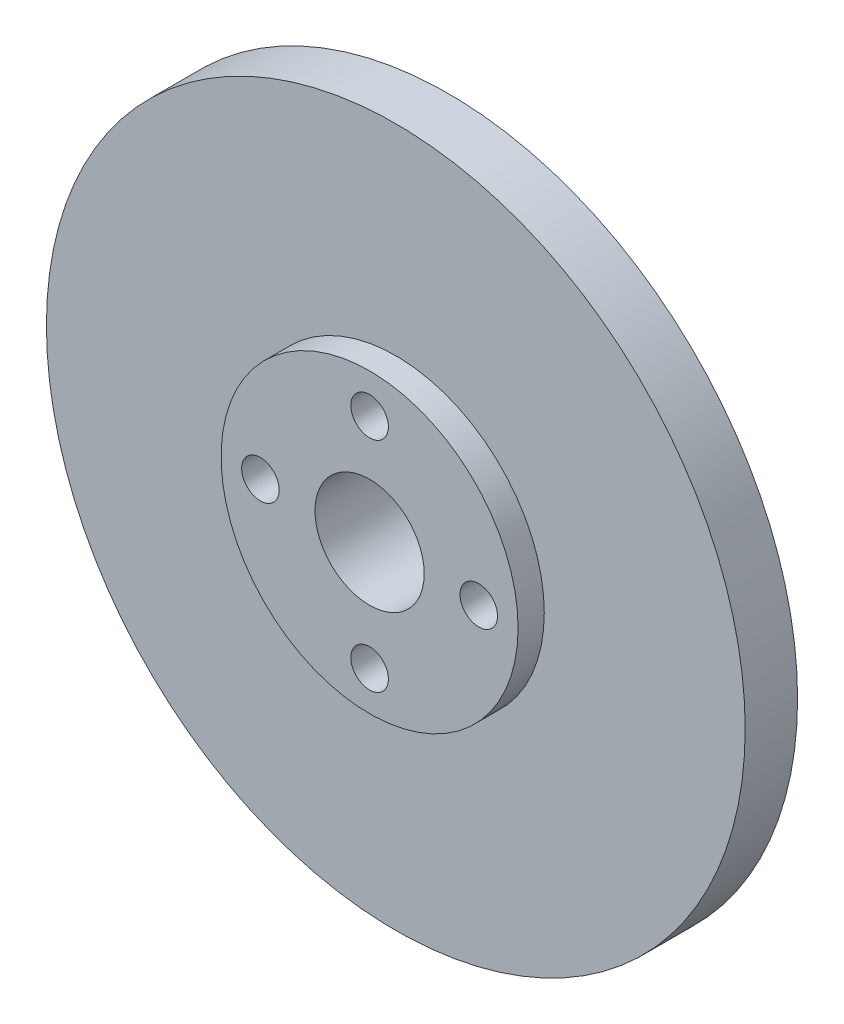
from build123d import *

# Parameters (mm, degrees)
SKETCH1_R               = 40
BOSS_EXTRUDE1_DEPTH     = 6
SKETCH2_R               = 17
BOSS_EXTRUDE2_DEPTH     = 3
CUT_EXTRUDE1_DEPTH      = 58.280013966
CUT_EXTRUDE1_DEPTH_BACK = 58.280013966
SKETCH3_R               = 6.25
SKETCH3_R_2             = 2.15


with BuildPart() as part:
    # Sketch1 → Boss-Extrude1 (new body)
    with BuildSketch(Plane.XY):
        Circle(SKETCH1_R)
    extrude(amount=BOSS_EXTRUDE1_DEPTH)

    # Sketch2 → Boss-Extrude2 (add)
    with BuildSketch(Plane.XY.offset(6)):
        Circle(SKETCH2_R)
    extrude(amount=BOSS_EXTRUDE2_DEPTH)

    # Sketch3 → Cut-Extrude1 (cut, two sides: drawn at the far end of the back side and taken through both)
    with BuildSketch(Plane.XY.offset(9).offset(-CUT_EXTRUDE1_DEPTH_BACK)):
        Circle(SKETCH3_R)
        with Locations((0, 12.5)):
            Circle(SKETCH3_R_2)
        with Locations((12.5, 0)):
            Circle(SKETCH3_R_2)
        with Locations((0, -12.5)):
            Circle(SKETCH3_R_2)
        with Locations((-12.5, 0)):
            Circle(SKETCH3_R_2)
    extrude(amount=CUT_EXTRUDE1_DEPTH + CUT_EXTRUDE1_DEPTH_BACK, mode=Mode.SUBTRACT)


solid = part.part
